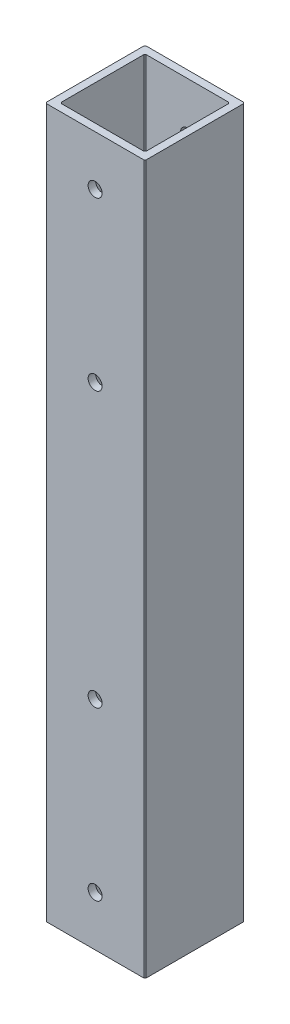
from build123d import *

# Parameters (mm, degrees)
SKETCH1_W                      = 40
SKETCH1_H                      = 284
BOSS_EXTRUDE1_DEPTH            = 40
SKETCH2_W                      = 34
SKETCH2_H                      = 34
CUT_EXTRUDE1_DEPTH             = 358.009803787
F_5_6_5_6_DIAMETER_HOLE1_D     = 5.6
F_5_6_5_6_DIAMETER_HOLE1_DEPTH = 3
F_5_6_5_6_DIAMETER_HOLE2_D     = 5.6
CHAMFER1_SIZE                  = 0.5


with BuildPart() as part:
    # Sketch1 → Boss-Extrude1 (new body)
    with BuildSketch(Plane.XY.offset(180)):
        with Locations((100, 0)):
            Rectangle(SKETCH1_W, SKETCH1_H)
    extrude(amount=-BOSS_EXTRUDE1_DEPTH)

    # Sketch2 → Cut-Extrude1 (cut, through all)
    with BuildSketch(Plane.XZ.offset(142)):
        with Locations((100, 160)):
            Rectangle(SKETCH2_W, SKETCH2_H)
    extrude(amount=-CUT_EXTRUDE1_DEPTH, mode=Mode.SUBTRACT)

    # Ø5.6 (5.6) Diameter Hole1
    with Locations(Plane(origin=(0, 0, 140), x_dir=(-1, 0, 0), z_dir=(0, 0, -1))):
        with Locations((-100, 122), (-100, 55), (-100, -55), (-100, -122)):
            Hole(F_5_6_5_6_DIAMETER_HOLE1_D / 2, depth=F_5_6_5_6_DIAMETER_HOLE1_DEPTH)

    # Ø5.6 (5.6) Diameter Hole2 (through all)
    with Locations(Plane(origin=(0, 0, 177), x_dir=(-1, 0, 0), z_dir=(0, 0, -1))):
        with Locations((-100, 122), (-100, 55), (-100, -55), (-100, -122)):
            Hole(F_5_6_5_6_DIAMETER_HOLE2_D / 2)

    # Chamfer1
    chamfer1_edges = [part.edges().sort_by_distance(p)[0] for p in [
        (120, 0, 140),
        (117, 0, 143),
        (83, 0, 143),
        (83, 0, 177),
        (117, 0, 177),
        (80, 0, 140),
        (120, 0, 180),
        (80, 0, 180),
    ]]
    chamfer(chamfer1_edges, length=CHAMFER1_SIZE)


solid = part.part
